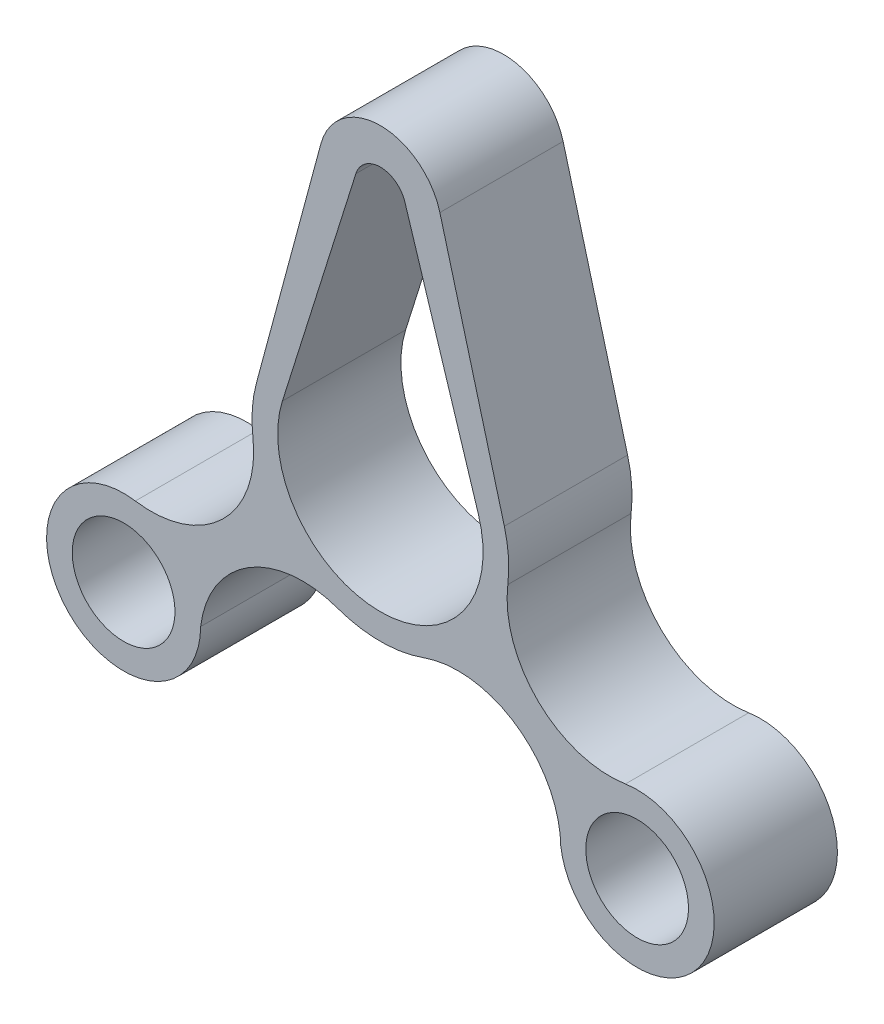
from build123d import *

# Parameters (mm, degrees)
SKETCH1_R           = 10
BOSS_EXTRUDE1_DEPTH = 24


with BuildPart() as part:
    # Sketch1 → Boss-Extrude1 (new body)
    with BuildSketch(Plane.XY):
        with BuildLine():
            Line((24.140215409, 6.5), (11.587303396, 53.12))
            ThreePointArc((11.587303396, 53.12), (0, 62), (-11.587303396, 53.12))
            Line((-11.587303396, 53.12), (-24.140215409, 6.5))
            ThreePointArc((-24.140215409, 6.5), (-24.936514863, 1.780512988), (-24.81883517, -3.004233816))
            ThreePointArc((-24.81883517, -3.004233816), (-30.762049538, -19.776348187), (-47.717387131, -25.174694658))
            ThreePointArc((-47.717387131, -25.174694658), (-61.385060233, -49.766289136), (-35, -40))
            ThreePointArc((-35, -40), (-25.668051324, -25.370335536), (-8.412024081, -23.542256707))
            ThreePointArc((-8.412024081, -23.542256707), (0, -25), (8.412024081, -23.542256707))
            ThreePointArc((8.412024081, -23.542256707), (25.668051324, -25.370335536), (35, -40))
            ThreePointArc((35, -40), (61.385060233, -49.766289136), (47.717387131, -25.174694658))
            ThreePointArc((47.717387131, -25.174694658), (30.762049538, -19.776348187), (24.81883517, -3.004233816))
            ThreePointArc((24.81883517, -3.004233816), (24.936514863, 1.780512988), (24.140215409, 6.5))
        make_face()
        with Locations((50, -40)):
            Circle(SKETCH1_R, mode=Mode.SUBTRACT)
        with Locations(Location((-50, -40, 0), (0, 0, 180))):
            Circle(SKETCH1_R, mode=Mode.SUBTRACT)
        with BuildLine():
            Line((4.769696007, 51.5), (19.078784028, 6))
            ThreePointArc((19.078784028, 6), (0, -20), (-19.078784028, 6))
            Line((-19.078784028, 6), (-4.769696007, 51.5))
            ThreePointArc((-4.769696007, 51.5), (0, 55), (4.769696007, 51.5))
        make_face(mode=Mode.SUBTRACT)
    extrude(amount=BOSS_EXTRUDE1_DEPTH)


solid = part.part
